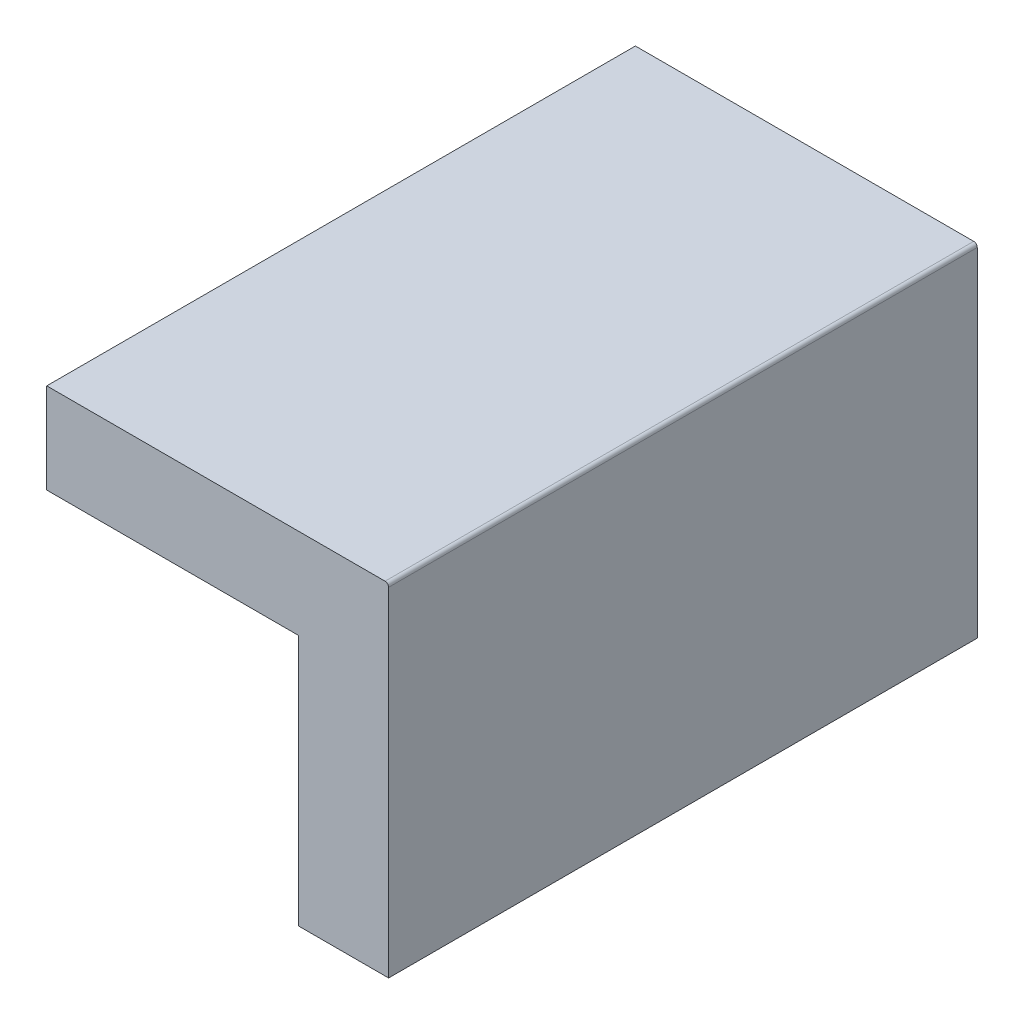
from build123d import *

# Parameters (mm, degrees)
BOSS_EXTRUDE2_DEPTH      = 304.8
BOSS_EXTRUDE2_DEPTH_BACK = 1286.002


with BuildPart() as part:
    # Sketch1 → Boss-Extrude2 (new, two sides: drawn at the far end of the back side and taken through both)
    with BuildSketch(Plane.XY.offset(-BOSS_EXTRUDE2_DEPTH_BACK)):
        with BuildLine():
            Line((0, -9.525), (0, -923.925))
            Line((0, -923.925), (-243.93812726, -923.925))
            Line((-243.93812726, -923.925), (-243.93812726, -243.93812726))
            Line((-243.93812726, -243.93812726), (-923.925, -243.93812726))
            Line((-923.925, -243.93812726), (-923.925, 0))
            Line((-923.925, 0), (-9.525, 0))
            ThreePointArc((-9.525, 0), (-2.789807909, -2.789807909), (0, -9.525))
        make_face()
    extrude(amount=BOSS_EXTRUDE2_DEPTH + BOSS_EXTRUDE2_DEPTH_BACK)


solid = part.part
